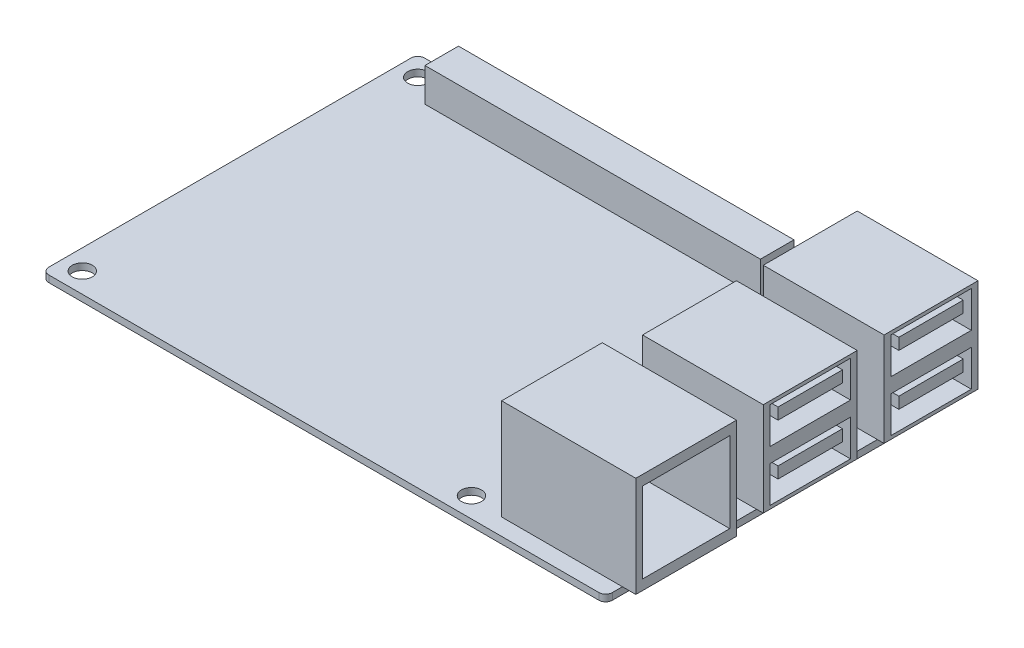
from build123d import *

# Parameters (mm, degrees)
SKETCH_1_R          = 1.5
EXTRUDE_1_DEPTH     = 1
SKETCH_3_W          = 18
SKETCH_3_H          = 14
SKETCH_3_W_2        = 20
SKETCH_3_H_2        = 15
EXTRUDE_2_DEPTH     = 15
SKETCH_4_W          = 12
SKETCH_4_H          = 5.4
SKETCH_4_W_2        = 9.6
SKETCH_4_H_2        = 1.7
CUT_EXTRUDE_1_DEPTH = 14
SKETCH_5_W          = 13
SKETCH_5_H          = 12
CUT_EXTRUDE_2_DEPTH = 14
SKETCH_2_W          = 50
SKETCH_2_H          = 5
EXTRUDE_3_DEPTH     = 5
SKETCH_7_W          = 14
SKETCH_7_H          = 1
CUT_EXTRUDE_5_DEPTH = 5


with BuildPart() as part:
    # Эскиз1 → Бобышка-Вытянуть1 (new body)
    with BuildSketch(Plane(origin=(0, 0, 0), x_dir=(1, 0, 0), z_dir=(0, 1, 0))):
        with BuildLine():
            Line((1, 0), (83, 0))
            ThreePointArc((83, 0), (83.707106781, 0.292893219), (84, 1))
            Line((84, 1), (84, 55))
            ThreePointArc((84, 55), (83.707106781, 55.707106781), (83, 56))
            Line((83, 56), (1, 56))
            ThreePointArc((1, 56), (0.292893219, 55.707106781), (0, 55))
            Line((0, 55), (0, 1))
            ThreePointArc((0, 1), (0.292893219, 0.292893219), (1, 0))
        make_face()
        with Locations(Location((3, 53, 0), (0, 0, 270))):
            Circle(SKETCH_1_R, mode=Mode.SUBTRACT)
        with Locations(Location((61, 53, 0), (0, 0, 270))):
            Circle(SKETCH_1_R, mode=Mode.SUBTRACT)
        with Locations(Location((61, 3, 0), (0, 0, 270))):
            Circle(SKETCH_1_R, mode=Mode.SUBTRACT)
        with Locations(Location((3, 3, 0), (0, 0, 270))):
            Circle(SKETCH_1_R, mode=Mode.SUBTRACT)
    extrude(amount=EXTRUDE_1_DEPTH)

    # Эскиз3 → Бобышка-Вытянуть2 (add)
    with BuildSketch(Plane(origin=(0, 1, 0), x_dir=(1, 0, 0), z_dir=(0, 1, 0))):
        with Locations((77, 28.5)):
            Rectangle(SKETCH_3_W, SKETCH_3_H)
        with Locations((76, 10)):
            Rectangle(SKETCH_3_W_2, SKETCH_3_H_2)
        with Locations((77, 46.5)):
            Rectangle(SKETCH_3_W, SKETCH_3_H)
    extrude(amount=EXTRUDE_2_DEPTH)

    # Эскиз4 → Вырез-Вытянуть1 (cut)
    # profile 1 of 4: a face of its own
    with BuildSketch(Plane(origin=(86, 0, 0), x_dir=(0, 0, -1), z_dir=(1, 0, 0))):
        with Locations((46.5, 12.8)):
            Rectangle(SKETCH_4_W, SKETCH_4_H)
        with Locations((46.5, 13.75)):
            Rectangle(SKETCH_4_W_2, SKETCH_4_H_2, mode=Mode.SUBTRACT)
    # profile 2 of 4: a face of its own
    with BuildSketch(Plane(origin=(86, 0, 0), x_dir=(0, 0, -1), z_dir=(1, 0, 0))):
        with Locations((46.5, 5.2)):
            Rectangle(SKETCH_4_W, SKETCH_4_H)
        with Locations((46.5, 6.15)):
            Rectangle(SKETCH_4_W_2, SKETCH_4_H_2, mode=Mode.SUBTRACT)
    # profile 3 of 4: a face of its own
    with BuildSketch(Plane(origin=(86, 0, 0), x_dir=(0, 0, -1), z_dir=(1, 0, 0))):
        with Locations((28.5, 5.2)):
            Rectangle(SKETCH_4_W, SKETCH_4_H)
        with Locations((28.5, 6.15)):
            Rectangle(SKETCH_4_W_2, SKETCH_4_H_2, mode=Mode.SUBTRACT)
    # profile 4 of 4: a face of its own
    with BuildSketch(Plane(origin=(86, 0, 0), x_dir=(0, 0, -1), z_dir=(1, 0, 0))):
        with Locations((28.5, 12.8)):
            Rectangle(SKETCH_4_W, SKETCH_4_H)
        with Locations((28.5, 13.75)):
            Rectangle(SKETCH_4_W_2, SKETCH_4_H_2, mode=Mode.SUBTRACT)
    extrude(amount=-CUT_EXTRUDE_1_DEPTH, mode=Mode.SUBTRACT)

    # Эскиз5 → Вырез-Вытянуть2 (cut)
    with BuildSketch(Plane(origin=(86, 0, 0), x_dir=(0, 0, -1), z_dir=(1, 0, 0))):
        with Locations((10, 8.5)):
            Rectangle(SKETCH_5_W, SKETCH_5_H)
    extrude(amount=-CUT_EXTRUDE_2_DEPTH, mode=Mode.SUBTRACT)

    # Эскиз2 → Бобышка-Вытянуть3 (add)
    with BuildSketch(Plane(origin=(0, 1, 0), x_dir=(1, 0, 0), z_dir=(0, 1, 0))):
        with Locations((32, 52.567639547)):
            Rectangle(SKETCH_2_W, SKETCH_2_H)
    extrude(amount=EXTRUDE_3_DEPTH)

    # Эскиз7 → Вырез-Вытянуть5 (cut)
    with BuildSketch(Plane(origin=(86, 0, 0), x_dir=(0, 0, -1), z_dir=(1, 0, 0))):
        with Locations((28.5, 1.5)):
            Rectangle(SKETCH_7_W, SKETCH_7_H)
        with Locations((46.5, 1.5)):
            Rectangle(SKETCH_7_W, SKETCH_7_H)
    extrude(amount=-CUT_EXTRUDE_5_DEPTH, mode=Mode.SUBTRACT)


solid = part.part
